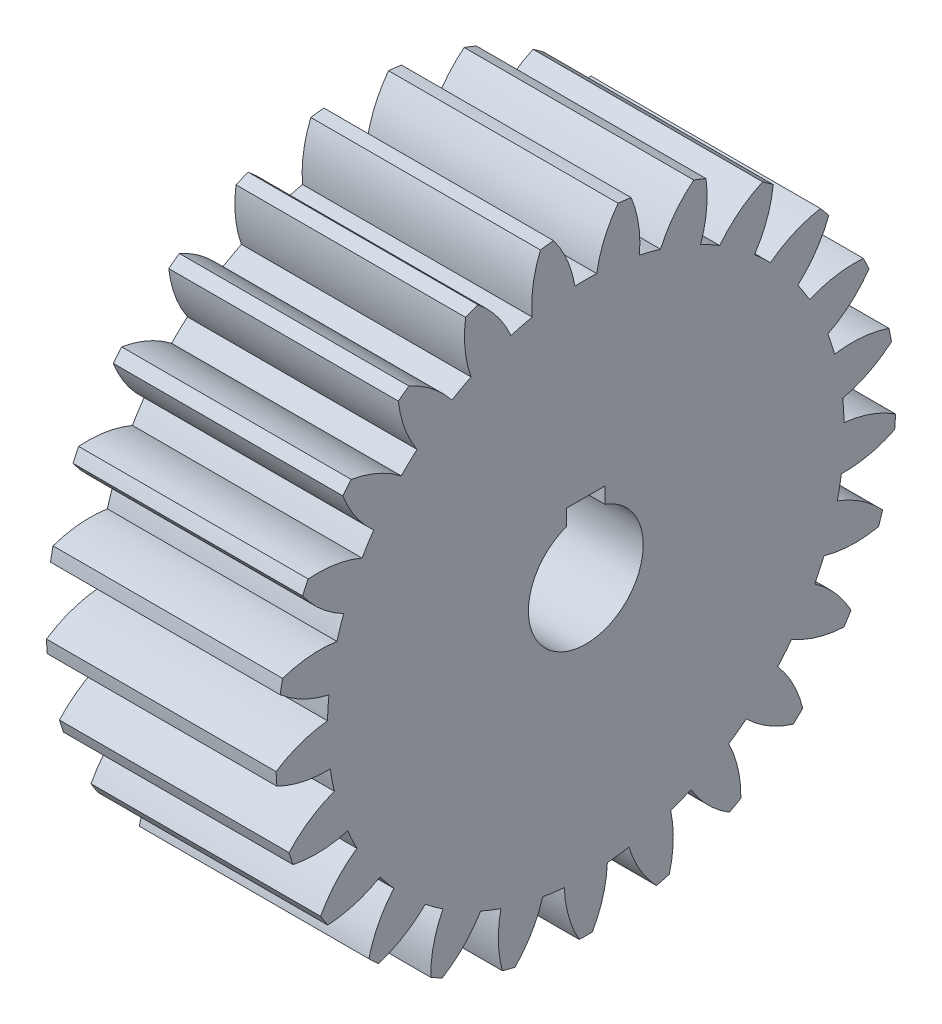
from build123d import *

# Parameters (mm, degrees)
BASPROSKE_W     = 60
BASPROSKE_H     = 81
TOOTHCUT_DEPTH  = 130.313572373
TEETHCUTS_COUNT = 25
TEETHCUTS_ANGLE = 345.6
BORSKE_R        = 15
BORE_DEPTH      = 60.0000508
KEYSKE_W        = 10
KEYSKE_H        = 18.3
KEYWAY_DEPTH    = 60.0000508


with BuildPart() as part:
    # BasProSke → Base-Revolve (revolve)
    with BuildSketch(Plane(origin=(0, 0, 0), x_dir=(1, 0, 0), z_dir=(0, 1, 0)), mode=Mode.PRIVATE) as base_revolve_sk:
        with Locations((30, 40.5)):
            Rectangle(BASPROSKE_W, BASPROSKE_H)
    revolve(base_revolve_sk.sketch.rotate(Axis((-10, 0, 0), (1, 0, 0)), 180), axis=Axis((-10, 0, 0), (1, 0, 0)))

    # TooCutSke → ToothCut (cut, through all)
    with BuildSketch(Plane(origin=(0, 0, 0), x_dir=(0, 0, -1), z_dir=(1, 0, 0))):
        with BuildLine():
            ThreePointArc((2.848248849, 67.438879584), (0, 67.499), (-2.848248849, 67.438879584))
            ThreePointArc((-2.848248849, 67.438879584), (-4.862018292, 74.3498133), (-8.464085034, 80.582099189))
            ThreePointArc((-8.464085034, 80.582099189), (0, 81.0254), (8.464085034, 80.582099189))
            ThreePointArc((8.464085034, 80.582099189), (4.862018292, 74.3498133), (2.848248849, 67.438879584))
        make_face()
    toothcut = extrude(amount=TOOTHCUT_DEPTH, mode=Mode.SUBTRACT)

    # TeethCuts: ToothCut ×25 about axis
    teethcuts_axis = Axis((-10, 0, 0), (1, 0, 0))
    for i in range(1, TEETHCUTS_COUNT):
        add(toothcut.rotate(teethcuts_axis, i * TEETHCUTS_ANGLE / (TEETHCUTS_COUNT - 1)), mode=Mode.SUBTRACT)

    # BorSke → Bore (cut, symmetric)
    with BuildSketch(Plane(origin=(0, 0, 0), x_dir=(0, 0, -1), z_dir=(1, 0, 0))):
        with Locations(Location((0, 0, 0), (0, 0, 180))):
            Circle(BORSKE_R)
    extrude(amount=BORE_DEPTH, both=True, mode=Mode.SUBTRACT)

    # KeySke → Keyway (cut, symmetric)
    with BuildSketch(Plane(origin=(0, 0, 0), x_dir=(0, 0, -1), z_dir=(1, 0, 0))):
        with Locations((0, 9.15)):
            Rectangle(KEYSKE_W, KEYSKE_H)
    extrude(amount=KEYWAY_DEPTH, both=True, mode=Mode.SUBTRACT)


solid = part.part
